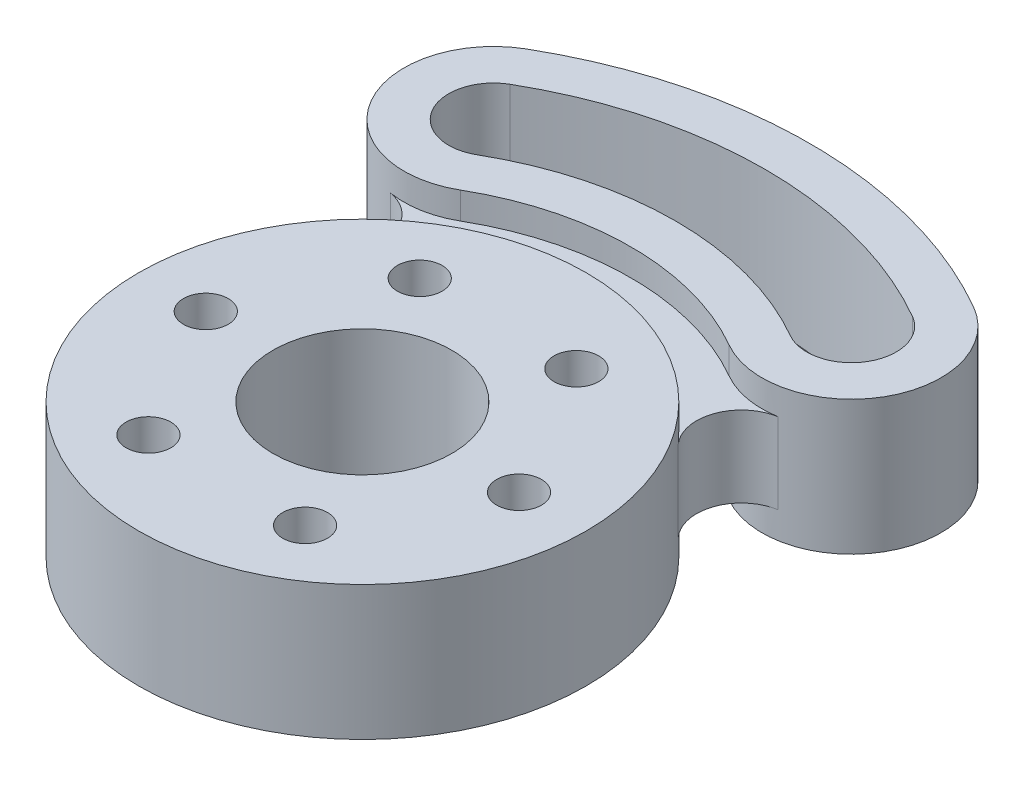
from build123d import *

# Parameters (mm, degrees)
SKETCH1_R             = 50
SKETCH1_R_2           = 5
SKETCH1_R_3           = 20
BOSS_EXTRUDE1_DEPTH   = 15
BOSS_EXTRUDE1_2_DEPTH = 15
BOSS_EXTRUDE2_DEPTH   = 9


with BuildPart() as part:
    # Sketch1 → Boss-Extrude1 (new, symmetric)
    with BuildSketch(Plane(origin=(0, 0, 0), x_dir=(1, 0, 0), z_dir=(0, 1, 0))):
        Circle(SKETCH1_R)
        with Locations((-17.5, -30.310889132)):
            Circle(SKETCH1_R_2, mode=Mode.SUBTRACT)
        with Locations((-35, 0)):
            Circle(SKETCH1_R_2, mode=Mode.SUBTRACT)
        Circle(SKETCH1_R_3, mode=Mode.SUBTRACT)
        with Locations((17.5, -30.310889132)):
            Circle(SKETCH1_R_2, mode=Mode.SUBTRACT)
        with Locations((35, 0)):
            Circle(SKETCH1_R_2, mode=Mode.SUBTRACT)
        with Locations((-17.5, 30.310889132)):
            Circle(SKETCH1_R_2, mode=Mode.SUBTRACT)
        with Locations((17.5, 30.310889132)):
            Circle(SKETCH1_R_2, mode=Mode.SUBTRACT)
    extrude(amount=BOSS_EXTRUDE1_DEPTH, both=True)



with BuildPart() as body_2:
    # Sketch1 → Boss-Extrude1 2 (new, symmetric)
    with BuildSketch(Plane(origin=(0, 0, 0), x_dir=(1, 0, 0), z_dir=(0, 1, 0))):
        with BuildLine():
            ThreePointArc((30, 51.961524227), (57.320508076, 59.282032303), (50, 86.602540378))
            ThreePointArc((50, 86.602540378), (0, 100), (-50, 86.602540378))
            ThreePointArc((-50, 86.602540378), (-57.320508076, 59.282032303), (-30, 51.961524227))
            ThreePointArc((-30, 51.961524227), (0, 60), (30, 51.961524227))
        make_face()
        with BuildLine():
            ThreePointArc((-45, 77.942286341), (0, 90), (45, 77.942286341))
            ThreePointArc((45, 77.942286341), (48.660254038, 64.282032303), (35, 60.621778265))
            ThreePointArc((35, 60.621778265), (0, 70), (-35, 60.621778265))
            ThreePointArc((-35, 60.621778265), (-48.660254038, 64.282032303), (-45, 77.942286341))
        make_face(mode=Mode.SUBTRACT)
    extrude(amount=BOSS_EXTRUDE1_2_DEPTH, both=True)


with BuildPart() as part_1:
    add(part.part)

    add(body_2.part)  # Boss-Extrude2 merges body 2
    # Sketch1<3> → Boss-Extrude2 (add, symmetric)
    with BuildSketch(Plane(origin=(0, 0, 0), x_dir=(1, 0, 0), z_dir=(0, 1, 0))):
        with BuildLine():
            ThreePointArc((-37.490169455, 33.08303484), (0, 50), (37.490169455, 33.08303484))
            ThreePointArc((37.490169455, 33.08303484), (35.561850492, 43.037885637), (43.325468897, 49.56043864))
            ThreePointArc((43.325468897, 49.56043864), (36.453361541, 49.599010288), (30, 51.961524227))
            ThreePointArc((30, 51.961524227), (0, 60), (-30, 51.961524227))
            ThreePointArc((-30, 51.961524227), (-36.453361541, 49.599010288), (-43.325468897, 49.56043864))
            ThreePointArc((-43.325468897, 49.56043864), (-35.561850492, 43.037885637), (-37.490169455, 33.08303484))
        make_face()
    extrude(amount=BOSS_EXTRUDE2_DEPTH, both=True)


solid = part_1.part
